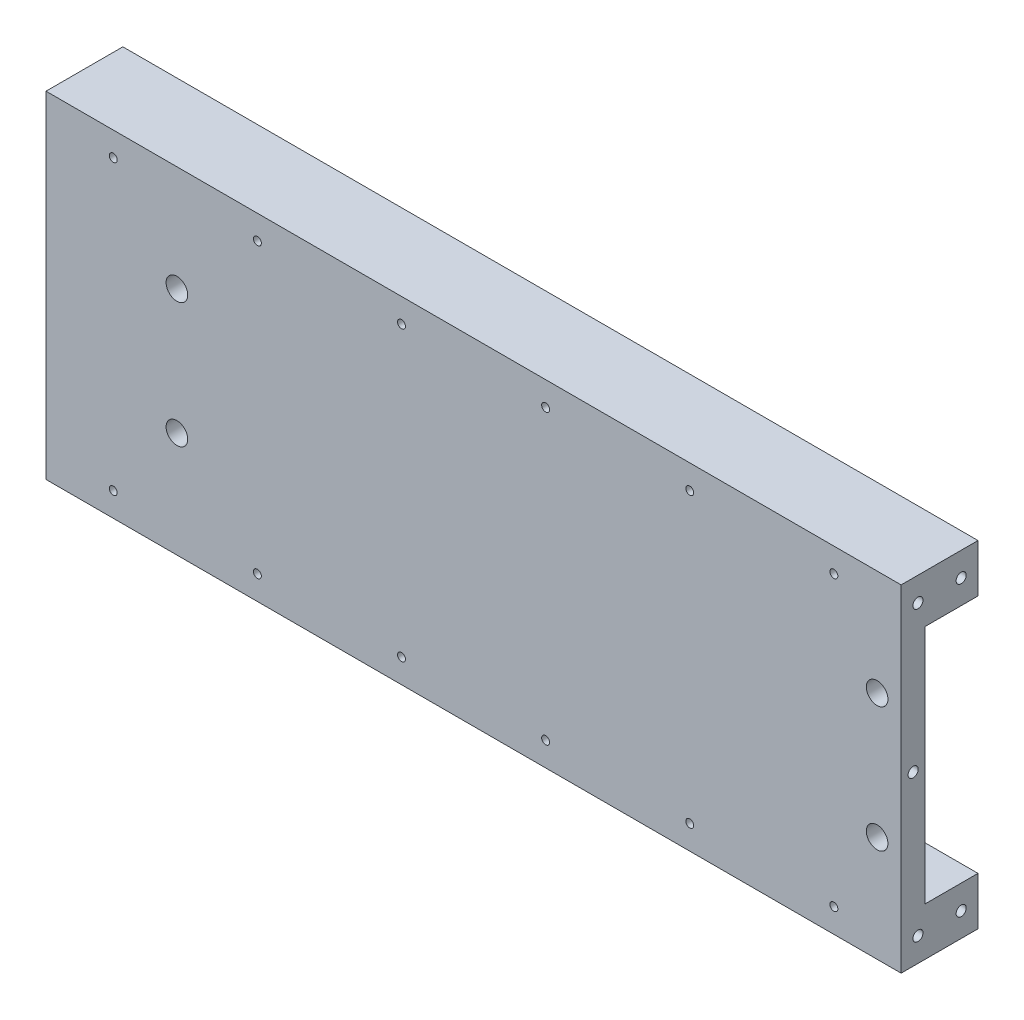
from build123d import *

# Parameters (mm, degrees)
EXTRUDE_1_DEPTH        = 356
HOLE_WIZARD_M5_1_D     = 4.2
HOLE_WIZARD_M5_1_DEPTH = 12
HOLE_WIZARD_M5_1_TIP   = 1.2618073
SKETCH_13_R            = 4.5
CUT_EXTRUDE_1_DEPTH    = 384.170980112
HOLE_WIZARD_M4_1_D     = 3.3
PATTERN_LINEAR_1_COUNT = 6
PATTERN_LINEAR_1_PITCH = 60
HOLE_WIZARD_M5_2_D     = 4.2
HOLE_WIZARD_M5_2_DEPTH = 12
HOLE_WIZARD_M5_2_TIP   = 1.2618073


with BuildPart() as part:
    # 草图1 → 凸台-拉伸1 (new body)
    with BuildSketch(Plane(origin=(0, 0, 0), x_dir=(0, 0, -1), z_dir=(1, 0, 0))):
        Polygon((0, 0), (32, 0), (32, -20), (10, -20), (10, -120), (32, -120), (32, -140), (0, -140), align=None)
    extrude(amount=EXTRUDE_1_DEPTH)

    # M5 螺纹孔1
    with Locations(Plane(origin=(356, -130, -25), x_dir=(0, 0, 1), z_dir=(1, 0, 0))):
        with Locations((0, 0), (18, 0), (18, -120), (0, -120), (20, -60)):
            Hole(HOLE_WIZARD_M5_1_D / 2, depth=HOLE_WIZARD_M5_1_DEPTH)
            with Locations((0, 0, -(HOLE_WIZARD_M5_1_DEPTH + HOLE_WIZARD_M5_1_TIP / 2))):  # 118° drill point
                Cone(0, HOLE_WIZARD_M5_1_D / 2, HOLE_WIZARD_M5_1_TIP, mode=Mode.SUBTRACT)

    # 草图13 → 切除-拉伸1 (cut, through all)
    with BuildSketch(Plane(origin=(0, 0, -10), x_dir=(-1, 0, 0), z_dir=(0, 0, -1))):
        with Locations(Location((-346, -44, 0), (0, 0, 90))):
            Circle(SKETCH_13_R)
        with Locations(Location((-346, -96, 0), (0, 0, 90))):
            Circle(SKETCH_13_R)
        with Locations(Location((-54.5, -44, 0), (0, 0, 90))):
            Circle(SKETCH_13_R)
        with Locations(Location((-54.5, -96, 0), (0, 0, 90))):
            Circle(SKETCH_13_R)
    extrude(amount=-CUT_EXTRUDE_1_DEPTH, mode=Mode.SUBTRACT)

    # M4 螺纹孔1 (through all)
    with Locations(Plane(origin=(328, -130, -32), x_dir=(-1, 0, 0), z_dir=(0, 0, -1))):
        with Locations((0, 0), (0, 120)):
            hole_wizard_m4_1 = Hole(HOLE_WIZARD_M4_1_D / 2)

    # 阵列(线性)1: M4 螺纹孔1 ×6
    with Locations(*[(-i * PATTERN_LINEAR_1_PITCH, 0, 0) for i in range(1, PATTERN_LINEAR_1_COUNT)]):
        add(hole_wizard_m4_1, mode=Mode.SUBTRACT)

    # M5 螺纹孔2
    with Locations(Plane.ZY):
        with Locations((-7, -10), (-25, -10), (-5, -70), (-7, -130), (-25, -130)):
            Hole(HOLE_WIZARD_M5_2_D / 2, depth=HOLE_WIZARD_M5_2_DEPTH)
            with Locations((0, 0, -(HOLE_WIZARD_M5_2_DEPTH + HOLE_WIZARD_M5_2_TIP / 2))):  # 118° drill point
                Cone(0, HOLE_WIZARD_M5_2_D / 2, HOLE_WIZARD_M5_2_TIP, mode=Mode.SUBTRACT)


solid = part.part
